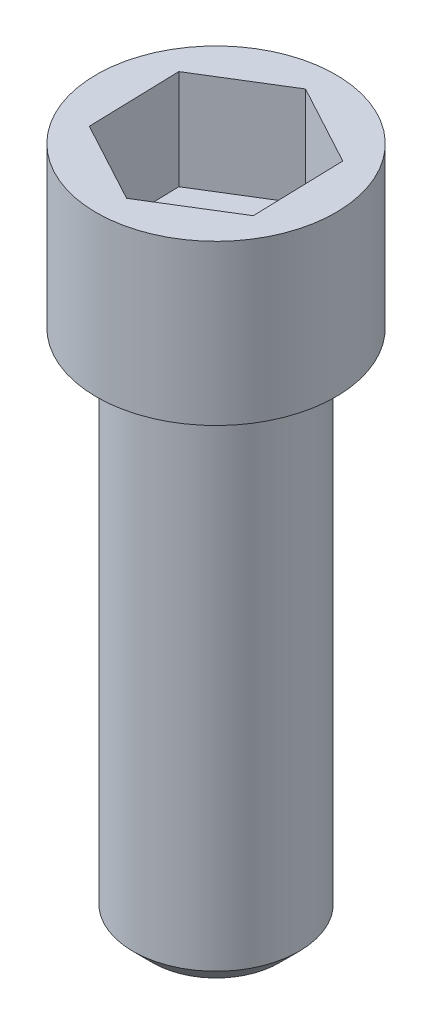
from build123d import *

# Parameters (mm, degrees)
SKETCH1_R           = 1.04
BOSS_EXTRUDE1_DEPTH = 6.5
SKETCH2_R           = 1.5
BOSS_EXTRUDE2_DEPTH = 2
CUT_EXTRUDE1_DEPTH  = 1.25
CHAMFER1_SIZE       = 0.25


with BuildPart() as part:
    # Sketch1 → Boss-Extrude1 (new body)
    with BuildSketch(Plane(origin=(0, 0, 0), x_dir=(1, 0, 0), z_dir=(0, 1, 0))):
        with Locations(Location((0, 0, 0), (0, 0, 90))):
            Circle(SKETCH1_R)
    extrude(amount=BOSS_EXTRUDE1_DEPTH)

    # Sketch2 → Boss-Extrude2 (add)
    with BuildSketch(Plane(origin=(0, 6.5, 0), x_dir=(1, 0, 0), z_dir=(0, 1, 0))):
        with Locations(Location((0, 0, 0), (0, 0, 270))):
            Circle(SKETCH2_R)
    extrude(amount=BOSS_EXTRUDE2_DEPTH)

    # Sketch3 → Cut-Extrude1 (cut)
    with BuildSketch(Plane(origin=(0, 8.5, 0), x_dir=(1, 0, 0), z_dir=(0, 1, 0))):
        Polygon((-0.032777471, 1.154235232), (-1.015985768, 0.548731493), (-0.983208297, -0.605503739), (0.032777471, -1.154235232), (1.015985768, -0.548731493), (0.983208297, 0.605503739), align=None)
    extrude(amount=-CUT_EXTRUDE1_DEPTH, mode=Mode.SUBTRACT)

    # Chamfer1
    chamfer1_edges = [part.edges().sort_by_distance(p)[0] for p in [
        (0, 0, 1.04),
    ]]
    chamfer(chamfer1_edges, length=CHAMFER1_SIZE)


solid = part.part
